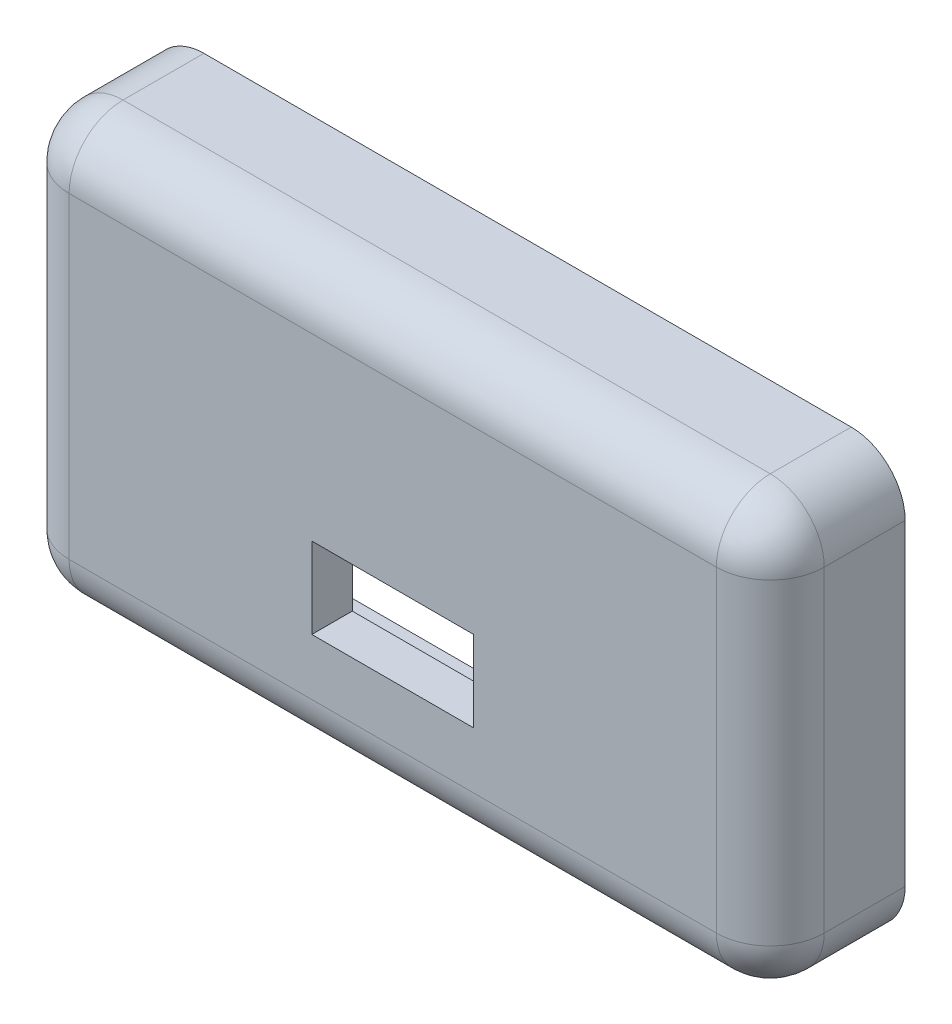
from build123d import *

# Parameters (mm, degrees)
SKETCH1_W           = 28
SKETCH1_H           = 15.75
SKETCH1_W_2         = 6
SKETCH1_H_2         = 3
BOSS_EXTRUDE1_DEPTH = 1
CUT_EXTRUDE1_REACH  = 18.094
SKETCH2_R           = 1.475
SKETCH5_W           = 28
SKETCH5_H           = 15.75
SKETCH5_W_2         = 6
SKETCH5_H_2         = 3
BOSS_EXTRUDE4_DEPTH = 0.5
SKETCH3_R           = 2.475
SKETCH3_R_2         = 1.475
BOSS_EXTRUDE2_DEPTH = 1
SKETCH4_W           = 28
SKETCH4_H           = 15.75
SKETCH4_W_2         = 26
SKETCH4_H_2         = 13.75
BOSS_EXTRUDE3_DEPTH = 3.5
FILLET1_R           = 2


with BuildPart() as part:
    # Sketch1 → Boss-Extrude1 (new body)
    with BuildSketch(Plane.XY):
        Rectangle(SKETCH1_W, SKETCH1_H)
        with Locations((0, -2.285)):
            Rectangle(SKETCH1_W_2, SKETCH1_H_2, mode=Mode.SUBTRACT)
    extrude(amount=BOSS_EXTRUDE1_DEPTH)

    # Sketch2 → Cut-Extrude1 (cut, up to next)
    with BuildSketch(Plane.XY.offset(1), mode=Mode.PRIVATE) as cut_extrude1_sk1:
        with Locations((10, 0)):
            Circle(SKETCH2_R)
    cut_extrude1_tool1 = extrude(cut_extrude1_sk1.sketch, amount=-CUT_EXTRUDE1_REACH, mode=Mode.PRIVATE) & part.part
    # Sketch2 → Cut-Extrude1 (cut, up to next)
    with BuildSketch(Plane.XY.offset(1), mode=Mode.PRIVATE) as cut_extrude1_sk2:
        with Locations((-10, 0)):
            Circle(SKETCH2_R)
    cut_extrude1_tool2 = extrude(cut_extrude1_sk2.sketch, amount=-CUT_EXTRUDE1_REACH, mode=Mode.PRIVATE) & part.part
    add(cut_extrude1_tool1.solids().sort_by_distance((10, 0, 1))[0], mode=Mode.SUBTRACT)
    add(cut_extrude1_tool2.solids().sort_by_distance((-10, 0, 1))[0], mode=Mode.SUBTRACT)

    # Sketch5 → Boss-Extrude4 (add)
    with BuildSketch(Plane.XY.offset(1)):
        Rectangle(SKETCH5_W, SKETCH5_H)
        with Locations((0, -2.285)):
            Rectangle(SKETCH5_W_2, SKETCH5_H_2, mode=Mode.SUBTRACT)
    extrude(amount=BOSS_EXTRUDE4_DEPTH)

    # Sketch3 → Boss-Extrude2 (add)
    # profile 1 of 2: a face of its own
    with BuildSketch(Plane(origin=(0, 0, 0), x_dir=(-1, 0, 0), z_dir=(0, 0, -1))):
        with Locations(Location((-10, 0, 0), (0, 0, 180))):
            Circle(SKETCH3_R)
        with Locations(Location((-10, 0, 0), (0, 0, 180))):
            Circle(SKETCH3_R_2, mode=Mode.SUBTRACT)
    # profile 2 of 2: a face of its own
    with BuildSketch(Plane(origin=(0, 0, 0), x_dir=(-1, 0, 0), z_dir=(0, 0, -1))):
        with Locations(Location((10, 0, 0), (0, 0, 180))):
            Circle(SKETCH3_R)
        with Locations(Location((10, 0, 0), (0, 0, 180))):
            Circle(SKETCH3_R_2, mode=Mode.SUBTRACT)
    extrude(amount=BOSS_EXTRUDE2_DEPTH)

    # Sketch4 → Boss-Extrude3 (add)
    with BuildSketch(Plane(origin=(0, 0, 0), x_dir=(-1, 0, 0), z_dir=(0, 0, -1))):
        Rectangle(SKETCH4_W, SKETCH4_H)
        Rectangle(SKETCH4_W_2, SKETCH4_H_2, mode=Mode.SUBTRACT)
    extrude(amount=BOSS_EXTRUDE3_DEPTH)

    # Fillet1
    fillet1_edges = [part.edges().sort_by_distance(p)[0] for p in [
        (0, -7.875, 1.5),
        (14, 0, 1.5),
        (0, 7.875, 1.5),
        (-14, 0, 1.5),
        (14, -7.875, -1),
        (-14, -7.875, -1),
        (-14, 7.875, -1),
        (14, 7.875, -1),
    ]]
    fillet(fillet1_edges, radius=FILLET1_R)


solid = part.part
